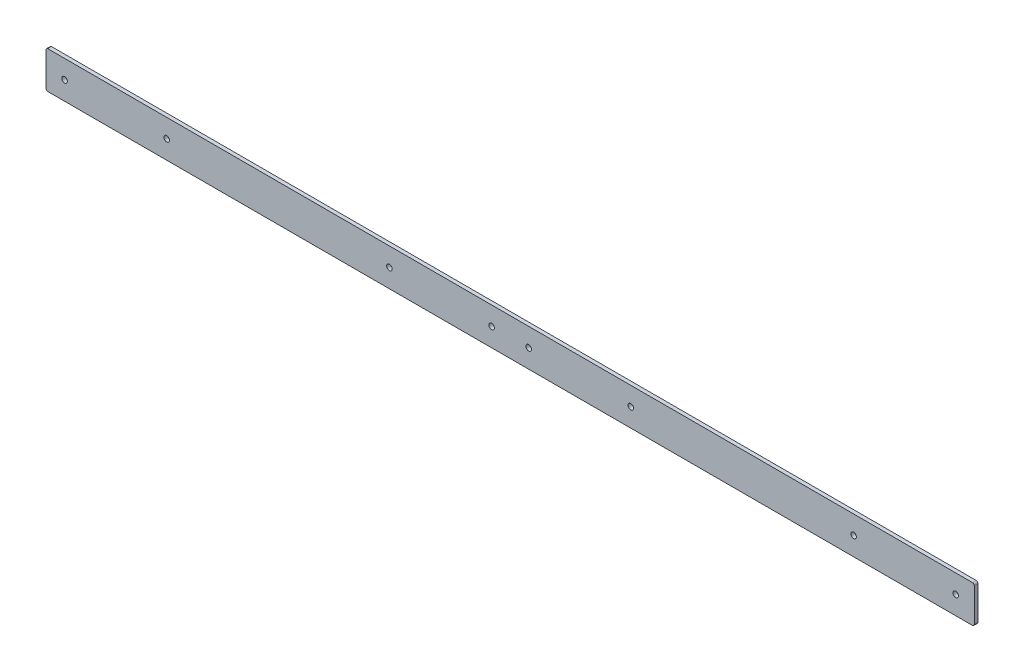
from build123d import *

# Parameters (mm, degrees)
SKETCH_1_W      = 500
SKETCH_1_H      = 20
SKETCH_1_R      = 1.5
EXTRUDE_1_DEPTH = 2
FILLET_1_R      = 1


with BuildPart() as part:
    # 草图1 → 凸台-拉伸1 (new body)
    with BuildSketch(Plane.XY):
        Rectangle(SKETCH_1_W, SKETCH_1_H)
        with Locations((240, 0)):
            Circle(SKETCH_1_R, mode=Mode.SUBTRACT)
        with Locations((185, 0)):
            Circle(SKETCH_1_R, mode=Mode.SUBTRACT)
        with Locations((-240, 0)):
            Circle(SKETCH_1_R, mode=Mode.SUBTRACT)
        with Locations((-185, 0)):
            Circle(SKETCH_1_R, mode=Mode.SUBTRACT)
        with Locations((-10, 0)):
            Circle(SKETCH_1_R, mode=Mode.SUBTRACT)
        with Locations((-65, 0)):
            Circle(SKETCH_1_R, mode=Mode.SUBTRACT)
        with Locations(Location((10, 0, 0), (0, 0, 180))):
            Circle(SKETCH_1_R, mode=Mode.SUBTRACT)
        with Locations(Location((65, 0, 0), (0, 0, 180))):
            Circle(SKETCH_1_R, mode=Mode.SUBTRACT)
    extrude(amount=EXTRUDE_1_DEPTH)

    # 圆角1
    fillet_1_edges = [part.edges().sort_by_distance(p)[0] for p in [
        (250, -10, 1),
        (-250, -10, 1),
        (-250, 10, 1),
        (250, 10, 1),
    ]]
    fillet(fillet_1_edges, radius=FILLET_1_R)


solid = part.part
